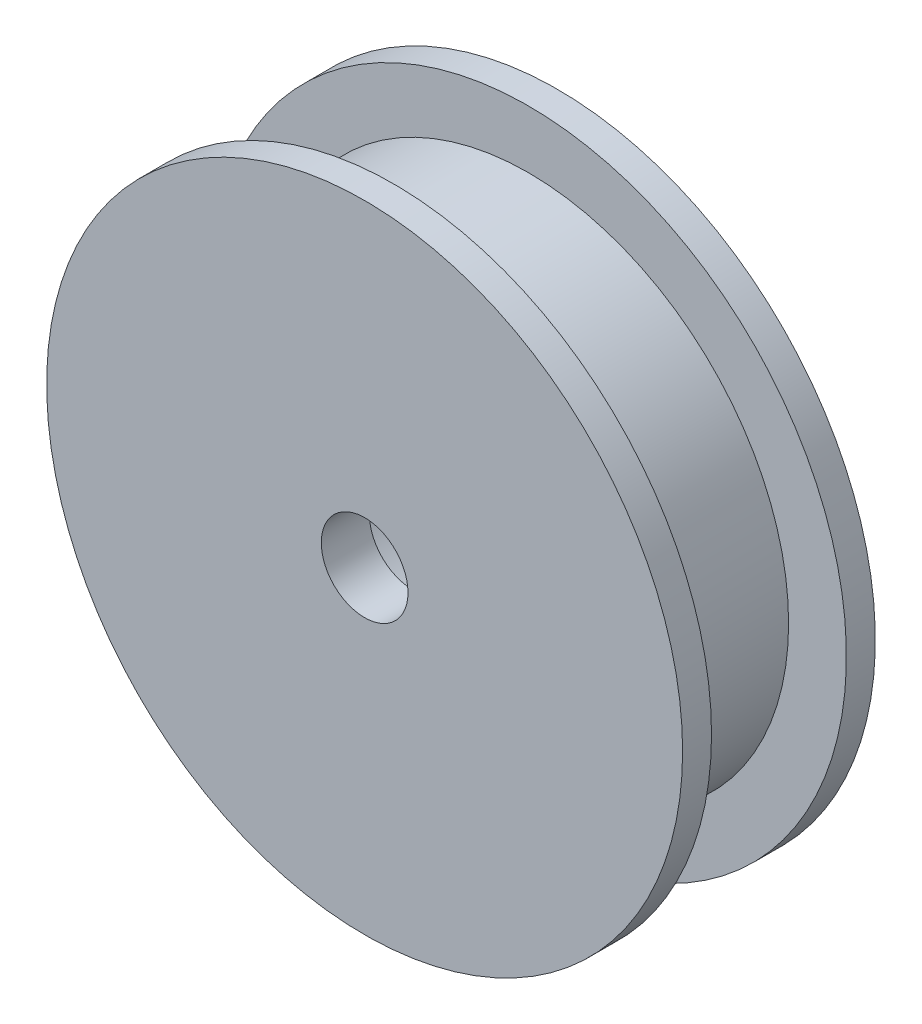
from build123d import *

# Parameters (mm, degrees)
SKETCH1_R           = 13.5
BOSS_EXTRUDE1_DEPTH = 7
SKETCH2_R           = 16.5
BOSS_EXTRUDE2_DEPTH = 1.5
BOSS_EXTRUDE3_START = 1.5
SKETCH3_R           = 16.5
BOSS_EXTRUDE3_DEPTH = 1.5
SKETCH4_R           = 6.5
CUT_EXTRUDE1_DEPTH  = 26.38700455
SKETCH5_R           = 6.5
SKETCH5_R_2         = 2.25
BOSS_EXTRUDE4_DEPTH = 2.5


with BuildPart() as part:
    # Sketch1 → Boss-Extrude1 (new body)
    with BuildSketch(Plane.XY):
        Circle(SKETCH1_R)
    extrude(amount=BOSS_EXTRUDE1_DEPTH)

    # Sketch2 → Boss-Extrude2 (add)
    with BuildSketch(Plane.XY.offset(7)):
        Circle(SKETCH2_R)
    extrude(amount=BOSS_EXTRUDE2_DEPTH)

    # Sketch3 → Boss-Extrude3 (add)
    with BuildSketch(Plane(origin=(0, 0, 0), x_dir=(-1, 0, 0), z_dir=(0, 0, -1)).offset(BOSS_EXTRUDE3_START)):
        with Locations(Location((0, 0, 0), (0, 0, 180))):
            Circle(SKETCH3_R)
    extrude(amount=-BOSS_EXTRUDE3_DEPTH)

    # Sketch4 → Cut-Extrude1 (cut, through all)
    with BuildSketch(Plane.XY.offset(8.5)):
        Circle(SKETCH4_R)
    extrude(amount=-CUT_EXTRUDE1_DEPTH, mode=Mode.SUBTRACT)

    # Sketch5 → Boss-Extrude4 (add)
    with BuildSketch(Plane.XY.offset(8.5)):
        Circle(SKETCH5_R)
        Circle(SKETCH5_R_2, mode=Mode.SUBTRACT)
    extrude(amount=-BOSS_EXTRUDE4_DEPTH)


solid = part.part
